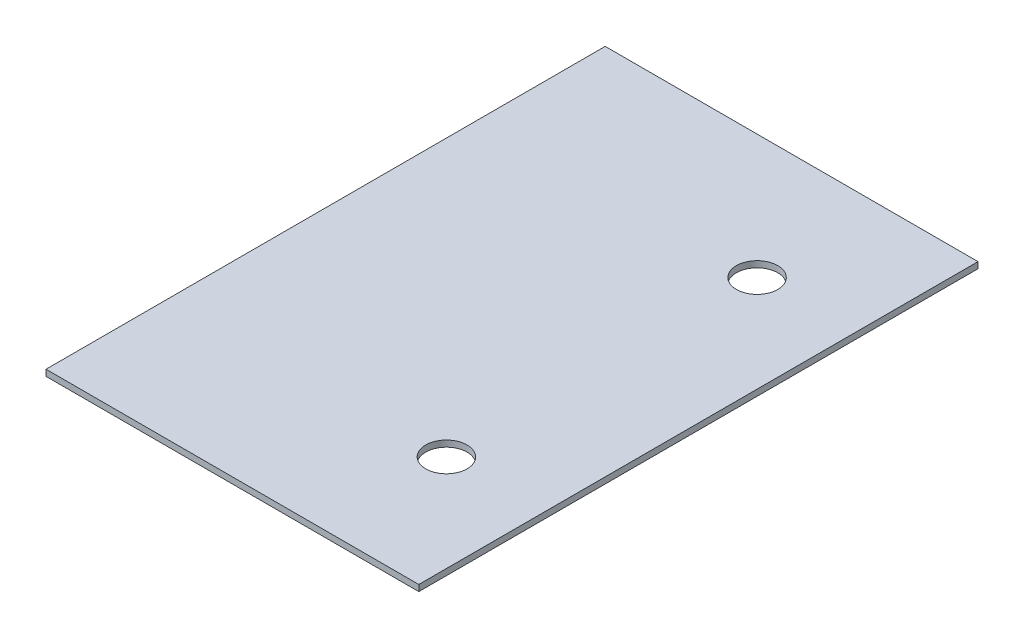
from build123d import *

# Parameters (mm, degrees)
SKETCH1_W           = 30
SKETCH1_H           = 45
BOSS_EXTRUDE1_DEPTH = 0.5
CUT_EXTRUDE1_REACH  = 29.046
SKETCH2_R           = 1.665


with BuildPart() as part:
    # Sketch1 → Boss-Extrude1 (new body)
    with BuildSketch(Plane(origin=(0, 0, 0), x_dir=(1, 0, 0), z_dir=(0, 1, 0))):
        Rectangle(SKETCH1_W, SKETCH1_H)
    extrude(amount=BOSS_EXTRUDE1_DEPTH)

    # Sketch2 → Cut-Extrude1 (cut, up to next)
    with BuildSketch(Plane(origin=(0, 0.5, 0), x_dir=(1, 0, 0), z_dir=(0, 1, 0)), mode=Mode.PRIVATE) as cut_extrude1_sk1:
        with Locations(Location((7.221380866, 12.5, 0), (0, 0, 270))):
            Circle(SKETCH2_R)
    cut_extrude1_tool1 = extrude(cut_extrude1_sk1.sketch, amount=-CUT_EXTRUDE1_REACH, mode=Mode.PRIVATE) & part.part
    # Sketch2 → Cut-Extrude1 (cut, up to next)
    with BuildSketch(Plane(origin=(0, 0.5, 0), x_dir=(1, 0, 0), z_dir=(0, 1, 0)), mode=Mode.PRIVATE) as cut_extrude1_sk2:
        with Locations(Location((7.221380866, -12.5, 0), (0, 0, 270))):
            Circle(SKETCH2_R)
    cut_extrude1_tool2 = extrude(cut_extrude1_sk2.sketch, amount=-CUT_EXTRUDE1_REACH, mode=Mode.PRIVATE) & part.part
    add(cut_extrude1_tool1.solids().sort_by_distance((7.221381, 0.5, -12.5))[0], mode=Mode.SUBTRACT)
    add(cut_extrude1_tool2.solids().sort_by_distance((7.221381, 0.5, 12.5))[0], mode=Mode.SUBTRACT)


solid = part.part
